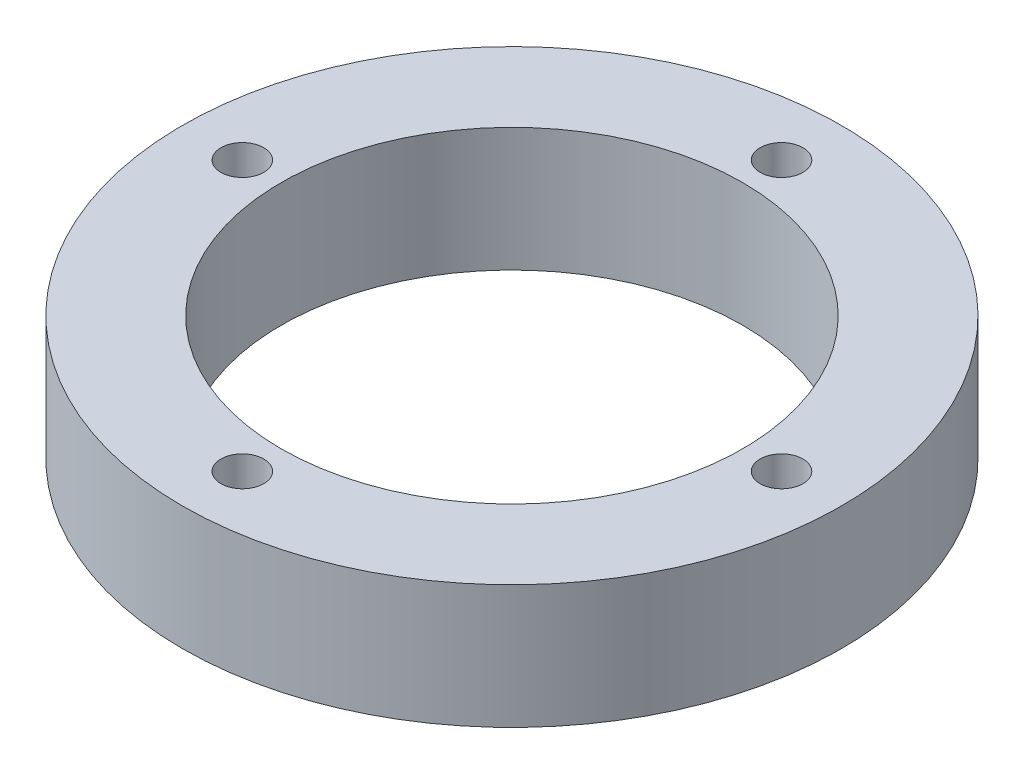
from build123d import *

# Parameters (mm, degrees)
SKETCH1_R      = 25.4
SKETCH1_R_2    = 17.78
SKETCH1_R_3    = 1.651
EXTRUDE1_DEPTH = 9.525


with BuildPart() as part:
    # Sketch1 → Extrude1 (new body)
    with BuildSketch(Plane(origin=(0, 0, 0), x_dir=(1, 0, 0), z_dir=(0, 1, 0))):
        with Locations(Location((0, 0, 0), (0, 0, 270))):
            Circle(SKETCH1_R)
        with Locations(Location((0, 0, 0), (0, 0, 270))):
            Circle(SKETCH1_R_2, mode=Mode.SUBTRACT)
        with Locations(Location((0, 20.7772, 0), (0, 0, 270))):
            Circle(SKETCH1_R_3, mode=Mode.SUBTRACT)
        with Locations(Location((0, -20.7772, 0), (0, 0, 90))):
            Circle(SKETCH1_R_3, mode=Mode.SUBTRACT)
        with Locations(Location((20.7772, 0, 0), (0, 0, 270))):
            Circle(SKETCH1_R_3, mode=Mode.SUBTRACT)
        with Locations(Location((-20.7772, 0, 0), (0, 0, 90))):
            Circle(SKETCH1_R_3, mode=Mode.SUBTRACT)
    extrude(amount=EXTRUDE1_DEPTH)


solid = part.part
